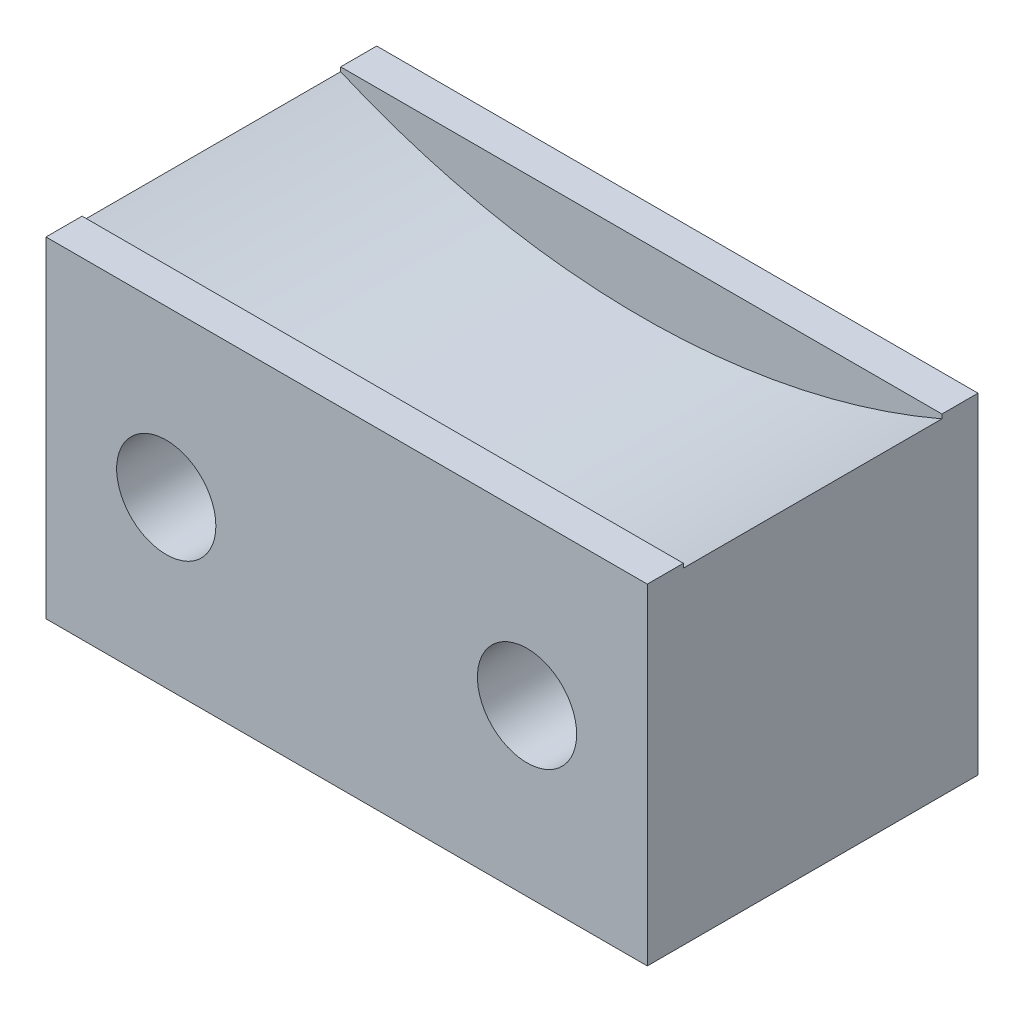
from build123d import *

# Parameters (mm, degrees)
BOSS_EXTRUDE1_DEPTH           = 10
BOSS_EXTRUDE1_DEPTH_BACK      = 10
SKETCH1_W                     = 11
SKETCH1_H                     = 11
SKETCH3_R                     = 1.65
M4_THREADED_3_3_MM_THRU_DEPTH = 38.199596772
CUT_EXTRUDE1_DEPTH            = 4.3
CUT_EXTRUDE1_DEPTH_BACK       = 4.3
SKETCH4_R                     = 25.3


with BuildPart() as part:
    # Sketch1 → Boss-Extrude1 (new, two sides: drawn at the far end of the back side and taken through both)
    with BuildSketch(Plane(origin=(0, 0, 0), x_dir=(0, 0, -1), z_dir=(1, 0, 0)).offset(-BOSS_EXTRUDE1_DEPTH_BACK)):
        with Locations((0, -28.6)):
            Rectangle(SKETCH1_W, SKETCH1_H)
    extrude(amount=BOSS_EXTRUDE1_DEPTH + BOSS_EXTRUDE1_DEPTH_BACK)

    # Sketch3 → M4 threaded 3.3 mm-thru (cut, through all)
    with BuildSketch(Plane.XY.offset(5.5)):
        with Locations((6, -28.6)):
            Circle(SKETCH3_R)
        with Locations((-6, -28.6)):
            Circle(SKETCH3_R)
    extrude(amount=-M4_THREADED_3_3_MM_THRU_DEPTH, mode=Mode.SUBTRACT)

    # Sketch4 → Cut-Extrude1 (cut, two sides: drawn at the far end of the back side and taken through both)
    with BuildSketch(Plane.XY.offset(-CUT_EXTRUDE1_DEPTH_BACK)):
        Circle(SKETCH4_R)
    extrude(amount=CUT_EXTRUDE1_DEPTH + CUT_EXTRUDE1_DEPTH_BACK, mode=Mode.SUBTRACT)


solid = part.part
